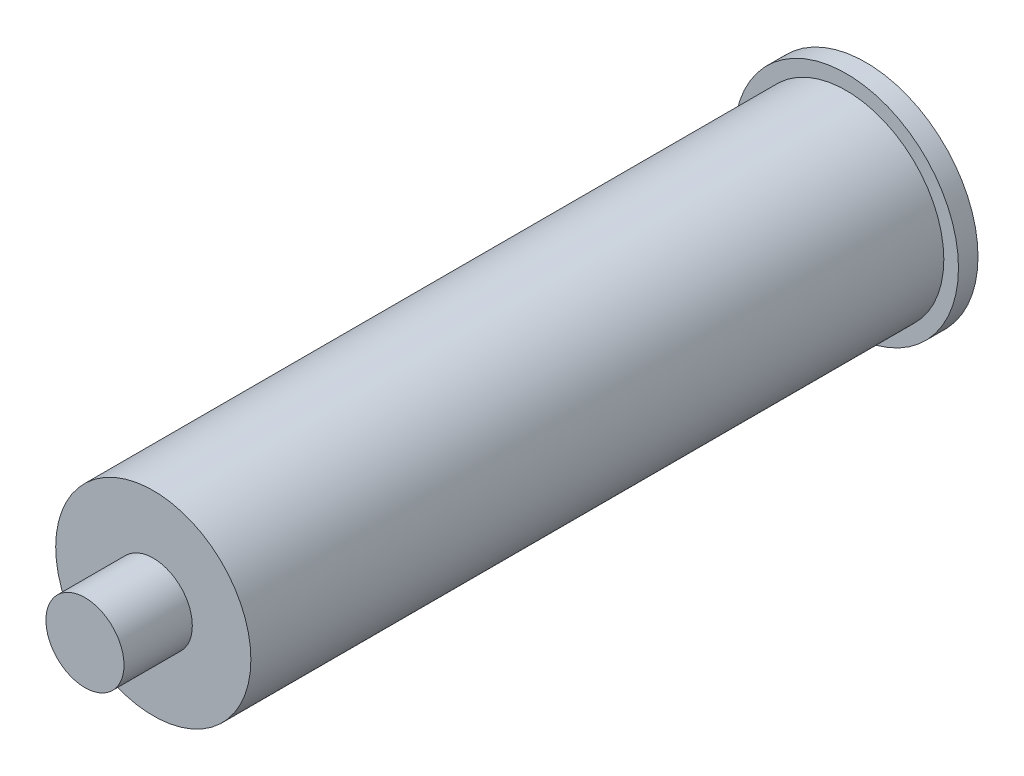
from build123d import *

# Parameters (mm, degrees)
BOSS_EXTRUDE1_DEPTH      = 35.5
BOSS_EXTRUDE1_DEPTH_BACK = 35.5
SKETCH1_R                = 10
CUT_EXTRUDE1_DEPTH       = 6
SKETCH3_R                = 4
BOSS_EXTRUDE2_DEPTH      = 7
SKETCH4_R                = 11.5
SKETCH4_R_2              = 8.5
BOSS_EXTRUDE3_DEPTH      = 2


with BuildPart() as part:
    # Sketch1 → Boss-Extrude1 (new, two sides: drawn at the far end of the back side and taken through both)
    with BuildSketch(Plane.XY.offset(-BOSS_EXTRUDE1_DEPTH_BACK)):
        Circle(SKETCH1_R)
    extrude(amount=BOSS_EXTRUDE1_DEPTH + BOSS_EXTRUDE1_DEPTH_BACK)

    # Sketch2 → Cut-Extrude1 (cut)
    with BuildSketch(Plane(origin=(0, 0, -35.5), x_dir=(-1, 0, 0), z_dir=(0, 0, -1))):
        Polygon((7.101408311, 0), (3.550704156, 6.15), (-3.550704156, 6.15), (-7.101408311, 0), (-3.550704156, -6.15), (3.550704156, -6.15), align=None)
    extrude(amount=-CUT_EXTRUDE1_DEPTH, mode=Mode.SUBTRACT)

    # Sketch3 → Boss-Extrude2 (add)
    with BuildSketch(Plane.XY.offset(35.5)):
        Circle(SKETCH3_R)
    extrude(amount=BOSS_EXTRUDE2_DEPTH)

    # Sketch4 → Boss-Extrude3 (add)
    with BuildSketch(Plane(origin=(0, 0, -35.5), x_dir=(-1, 0, 0), z_dir=(0, 0, -1))):
        Circle(SKETCH4_R)
        Circle(SKETCH4_R_2, mode=Mode.SUBTRACT)
    extrude(amount=BOSS_EXTRUDE3_DEPTH)


solid = part.part
